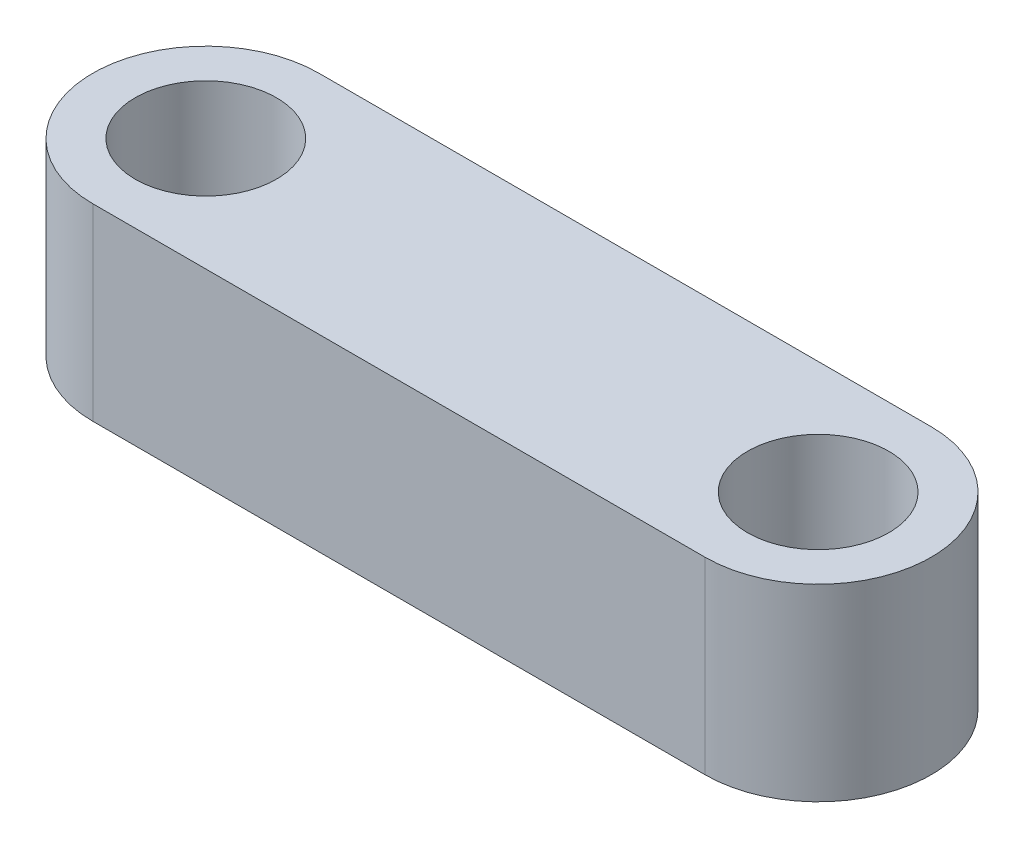
from build123d import *

# Parameters (mm, degrees)
SKETCH1_R           = 1.190625
BOSS_EXTRUDE1_DEPTH = 3.175


with BuildPart() as part:
    # Sketch1 → Boss-Extrude1 (new body)
    with BuildSketch(Plane(origin=(0, 0, 0), x_dir=(1, 0, 0), z_dir=(0, 1, 0))):
        with BuildLine():
            Line((-29.835251472, 5.934453632), (-19.516501472, 5.934453632))
            ThreePointArc((-19.516501472, 5.934453632), (-17.611501472, 4.029453632), (-19.516501472, 2.124453632))
            Line((-19.516501472, 2.124453632), (-29.835251472, 2.124453632))
            ThreePointArc((-29.835251472, 2.124453632), (-31.740251472, 4.029453632), (-29.835251472, 5.934453632))
        make_face()
        with Locations(Location((-29.835251472, 4.029453632, 0), (0, 0, 270))):
            Circle(SKETCH1_R, mode=Mode.SUBTRACT)
        with Locations(Location((-19.516501472, 4.029453632, 0), (0, 0, 270))):
            Circle(SKETCH1_R, mode=Mode.SUBTRACT)
    extrude(amount=BOSS_EXTRUDE1_DEPTH)


solid = part.part
